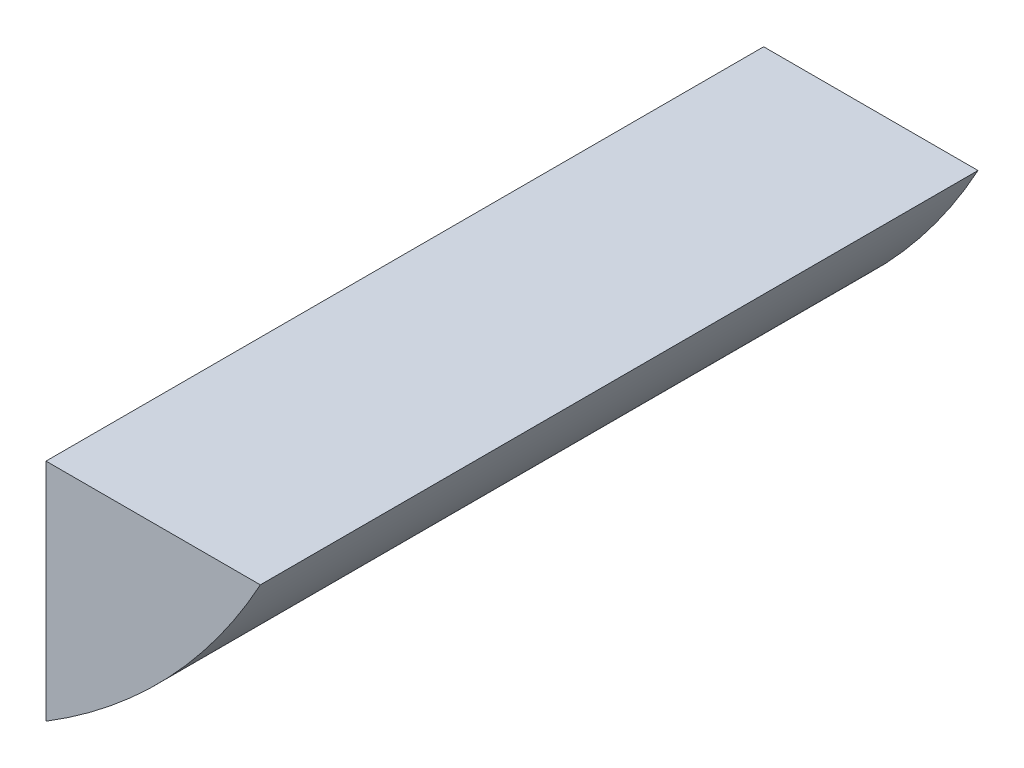
from build123d import *

# Parameters (mm, degrees)
DODANIE_WYCI_GNI_CIE1_DEPTH = 50


with BuildPart() as part:
    # Szkic1 → Dodanie-wyciągnięcie1 (new body)
    with BuildSketch(Plane.XY):
        with BuildLine():
            Line((32.959582694, -19.181460051), (18.026405253, -19.181460051))
            Line((18.026405253, -19.181460051), (18.026405253, -34.879475269))
            ThreePointArc((18.026405253, -34.879475269), (26.520137856, -28.007567099), (32.959582694, -19.181460051))
        make_face()
    extrude(amount=DODANIE_WYCI_GNI_CIE1_DEPTH)


solid = part.part
